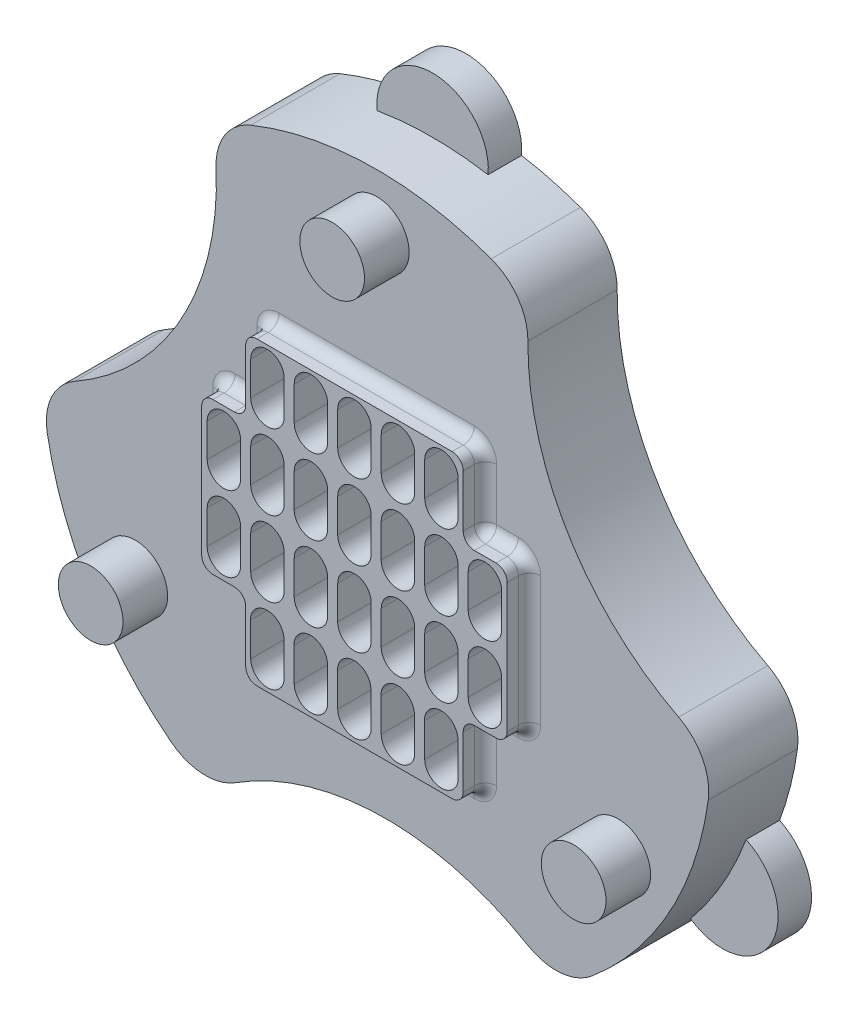
from build123d import *

# Parameters (mm, degrees)
SKETCH2_R           = 18.85
BOSS_EXTRUDE1_DEPTH = 8
SKETCH3_R           = 30
SKETCH3_R_2         = 17.600030795
BOSS_EXTRUDE2_DEPTH = 8
SKETCH4_R           = 2.9
BOSS_EXTRUDE3_DEPTH = 4
SKETCH6_R           = 5
BOSS_EXTRUDE4_DEPTH = 3
SKETCH5_R           = 3
CUT_EXTRUDE1_DEPTH  = 3
SKETCH7_R           = 25
CUT_EXTRUDE2_DEPTH  = 8
FILLET1_R           = 5
SKETCH2_2_R         = 18.85
BOSS_EXTRUDE5_DEPTH = 10
SKETCH8_R           = 20.511068925
CUT_EXTRUDE3_DEPTH  = 2
FILLET2_R           = 1
FILLET3_R           = 1


with BuildPart() as part:
    # Sketch2 → Boss-Extrude1 (new body)
    with BuildSketch(Plane.XY.offset(10)):
        Circle(SKETCH2_R)
        with BuildLine():
            Line((-6.300750604, 11.631897337), (-6.301949779, 8.631897576))
            ThreePointArc((-6.301949779, 8.631897576), (-7.802549247, 7.132497284), (-9.30194954, 8.633096752))
            Line((-9.30194954, 8.633096752), (-9.300750364, 11.633096512))
            ThreePointArc((-9.300750364, 11.633096512), (-7.800150896, 13.132496805), (-6.300750604, 11.631897337))
        make_face(mode=Mode.SUBTRACT)
        with BuildLine():
            Line((-5.400750364, 11.633096512), (-5.40194954, 8.633096752))
            ThreePointArc((-5.40194954, 8.633096752), (-3.902549247, 7.132497284), (-2.401949779, 8.631897576))
            Line((-2.401949779, 8.631897576), (-2.400750604, 11.631897337))
            ThreePointArc((-2.400750604, 11.631897337), (-3.900150896, 13.132496805), (-5.400750364, 11.633096512))
        make_face(mode=Mode.SUBTRACT)
        with BuildLine():
            Line((-1.500750364, 11.633096512), (-1.50194954, 8.633096752))
            ThreePointArc((-1.50194954, 8.633096752), (-0.002549247, 7.132497284), (1.498050221, 8.631897576))
            Line((1.498050221, 8.631897576), (1.499249396, 11.631897337))
            ThreePointArc((1.499249396, 11.631897337), (-0.000150896, 13.132496805), (-1.500750364, 11.633096512))
        make_face(mode=Mode.SUBTRACT)
        with BuildLine():
            Line((2.399249636, 11.633096512), (2.39805046, 8.633096752))
            ThreePointArc((2.39805046, 8.633096752), (3.897450753, 7.132497284), (5.398050221, 8.631897576))
            Line((5.398050221, 8.631897576), (5.399249396, 11.631897337))
            ThreePointArc((5.399249396, 11.631897337), (3.899849104, 13.132496805), (2.399249636, 11.633096512))
        make_face(mode=Mode.SUBTRACT)
        with BuildLine():
            Line((6.299249636, 11.633096512), (6.29805046, 8.633096752))
            ThreePointArc((6.29805046, 8.633096752), (7.797450753, 7.132497284), (9.298050221, 8.631897576))
            Line((9.298050221, 8.631897576), (9.299249396, 11.631897337))
            ThreePointArc((9.299249396, 11.631897337), (7.799849104, 13.132496805), (6.299249636, 11.633096512))
        make_face(mode=Mode.SUBTRACT)
        with BuildLine():
            Line((-10.203450815, 1.876748439), (-10.201950263, 4.876748439))
            ThreePointArc((-10.201950263, 4.876748439), (-11.701199799, 6.377498527), (-13.201949888, 4.878248991))
            Line((-13.201949888, 4.878248991), (-13.20345044, 1.878248991))
            ThreePointArc((-13.20345044, 1.878248991), (-11.704200903, 0.377498902), (-10.203450815, 1.876748439))
        make_face(mode=Mode.SUBTRACT)
        with BuildLine():
            Line((-9.303450024, 1.878248991), (-9.301949472, 4.878248991))
            ThreePointArc((-9.301949472, 4.878248991), (-7.801199384, 6.377498527), (-6.301949847, 4.876748439))
            Line((-6.301949847, 4.876748439), (-6.3034504, 1.876748439))
            ThreePointArc((-6.3034504, 1.876748439), (-7.804200488, 0.377498902), (-9.303450024, 1.878248991))
        make_face(mode=Mode.SUBTRACT)
        with BuildLine():
            Line((-2.4034504, 1.876748439), (-2.401949847, 4.876748439))
            ThreePointArc((-2.401949847, 4.876748439), (-3.901199384, 6.377498527), (-5.401949472, 4.878248991))
            Line((-5.401949472, 4.878248991), (-5.403450024, 1.878248991))
            ThreePointArc((-5.403450024, 1.878248991), (-3.904200488, 0.377498902), (-2.4034504, 1.876748439))
        make_face(mode=Mode.SUBTRACT)
        with BuildLine():
            Line((1.4965496, 1.876748439), (1.498050153, 4.876748439))
            ThreePointArc((1.498050153, 4.876748439), (-0.001199384, 6.377498527), (-1.501949472, 4.878248991))
            Line((-1.501949472, 4.878248991), (-1.503450024, 1.878248991))
            ThreePointArc((-1.503450024, 1.878248991), (-0.004200488, 0.377498902), (1.4965496, 1.876748439))
        make_face(mode=Mode.SUBTRACT)
        with BuildLine():
            Line((5.3965496, 1.876748439), (5.398050153, 4.876748439))
            ThreePointArc((5.398050153, 4.876748439), (3.898800616, 6.377498527), (2.398050528, 4.878248991))
            Line((2.398050528, 4.878248991), (2.396549976, 1.878248991))
            ThreePointArc((2.396549976, 1.878248991), (3.895799512, 0.377498902), (5.3965496, 1.876748439))
        make_face(mode=Mode.SUBTRACT)
        with BuildLine():
            Line((9.2965496, 1.876748439), (9.298050153, 4.876748439))
            ThreePointArc((9.298050153, 4.876748439), (7.798800616, 6.377498527), (6.298050528, 4.878248991))
            Line((6.298050528, 4.878248991), (6.296549976, 1.878248991))
            ThreePointArc((6.296549976, 1.878248991), (7.795799512, 0.377498902), (9.2965496, 1.876748439))
        make_face(mode=Mode.SUBTRACT)
        with BuildLine():
            Line((13.1965496, 1.876748439), (13.198050153, 4.876748439))
            ThreePointArc((13.198050153, 4.876748439), (11.698800616, 6.377498527), (10.198050528, 4.878248991))
            Line((10.198050528, 4.878248991), (10.196549976, 1.878248991))
            ThreePointArc((10.196549976, 1.878248991), (11.695799512, 0.377498902), (13.1965496, 1.876748439))
        make_face(mode=Mode.SUBTRACT)
        with BuildLine():
            Line((-9.304647729, -4.877109305), (-9.30074961, -1.877109305))
            ThreePointArc((-9.30074961, -1.877109305), (-7.798801818, -0.37905963), (-6.300752142, -1.881007421))
            Line((-6.300752142, -1.881007421), (-6.304650262, -4.881007421))
            ThreePointArc((-6.304650262, -4.881007421), (-7.806598054, -6.379057097), (-9.304647729, -4.877109305))
        make_face(mode=Mode.SUBTRACT)
        with BuildLine():
            Line((-2.404650262, -4.881007421), (-2.400752142, -1.881007421))
            ThreePointArc((-2.400752142, -1.881007421), (-3.898801818, -0.37905963), (-5.40074961, -1.877109305))
            Line((-5.40074961, -1.877109305), (-5.404647729, -4.877109305))
            ThreePointArc((-5.404647729, -4.877109305), (-3.906598054, -6.379057097), (-2.404650262, -4.881007421))
        make_face(mode=Mode.SUBTRACT)
        with BuildLine():
            Line((1.495349738, -4.881007421), (1.499247858, -1.881007421))
            ThreePointArc((1.499247858, -1.881007421), (0.001198182, -0.37905963), (-1.50074961, -1.877109305))
            Line((-1.50074961, -1.877109305), (-1.504647729, -4.877109305))
            ThreePointArc((-1.504647729, -4.877109305), (-0.006598054, -6.379057097), (1.495349738, -4.881007421))
        make_face(mode=Mode.SUBTRACT)
        with BuildLine():
            Line((5.395349738, -4.881007421), (5.399247858, -1.881007421))
            ThreePointArc((5.399247858, -1.881007421), (3.901198182, -0.37905963), (2.39925039, -1.877109305))
            Line((2.39925039, -1.877109305), (2.395352271, -4.877109305))
            ThreePointArc((2.395352271, -4.877109305), (3.893401946, -6.379057097), (5.395349738, -4.881007421))
        make_face(mode=Mode.SUBTRACT)
        with BuildLine():
            Line((9.295349738, -4.881007421), (9.299247858, -1.881007421))
            ThreePointArc((9.299247858, -1.881007421), (7.801198182, -0.37905963), (6.29925039, -1.877109305))
            Line((6.29925039, -1.877109305), (6.295352271, -4.877109305))
            ThreePointArc((6.295352271, -4.877109305), (7.793401946, -6.379057097), (9.295349738, -4.881007421))
        make_face(mode=Mode.SUBTRACT)
        with BuildLine():
            Line((13.195349738, -4.881007421), (13.199247858, -1.881007421))
            ThreePointArc((13.199247858, -1.881007421), (11.701198182, -0.37905963), (10.19925039, -1.877109305))
            Line((10.19925039, -1.877109305), (10.195352271, -4.877109305))
            ThreePointArc((10.195352271, -4.877109305), (11.693401946, -6.379057097), (13.195349738, -4.881007421))
        make_face(mode=Mode.SUBTRACT)
        with BuildLine():
            Line((-10.204650262, -4.881007421), (-10.200752142, -1.881007421))
            ThreePointArc((-10.200752142, -1.881007421), (-11.698801818, -0.37905963), (-13.20074961, -1.877109305))
            Line((-13.20074961, -1.877109305), (-13.204647729, -4.877109305))
            ThreePointArc((-13.204647729, -4.877109305), (-11.706598054, -6.379057097), (-10.204650262, -4.881007421))
        make_face(mode=Mode.SUBTRACT)
        with BuildLine():
            Line((-6.325942117, -8.623046013), (-6.300802019, -11.623046013))
            ThreePointArc((-6.300802019, -11.623046013), (-7.788179745, -13.135562955), (-9.300696687, -11.648185229))
            Line((-9.300696687, -11.648185229), (-9.325836785, -8.648185229))
            ThreePointArc((-9.325836785, -8.648185229), (-7.838459059, -7.135668287), (-6.325942117, -8.623046013))
        make_face(mode=Mode.SUBTRACT)
        with BuildLine():
            Line((-5.425836785, -8.648185229), (-5.400696687, -11.648185229))
            ThreePointArc((-5.400696687, -11.648185229), (-3.888179745, -13.135562955), (-2.400802019, -11.623046013))
            Line((-2.400802019, -11.623046013), (-2.425942117, -8.623046013))
            ThreePointArc((-2.425942117, -8.623046013), (-3.938459059, -7.135668287), (-5.425836785, -8.648185229))
        make_face(mode=Mode.SUBTRACT)
        with BuildLine():
            Line((-1.525836785, -8.648185229), (-1.500696687, -11.648185229))
            ThreePointArc((-1.500696687, -11.648185229), (0.011820255, -13.135562955), (1.499197981, -11.623046013))
            Line((1.499197981, -11.623046013), (1.474057883, -8.623046013))
            ThreePointArc((1.474057883, -8.623046013), (-0.038459059, -7.135668287), (-1.525836785, -8.648185229))
        make_face(mode=Mode.SUBTRACT)
        with BuildLine():
            Line((2.374163215, -8.648185229), (2.399303313, -11.648185229))
            ThreePointArc((2.399303313, -11.648185229), (3.911820255, -13.135562955), (5.399197981, -11.623046013))
            Line((5.399197981, -11.623046013), (5.374057883, -8.623046013))
            ThreePointArc((5.374057883, -8.623046013), (3.861540941, -7.135668287), (2.374163215, -8.648185229))
        make_face(mode=Mode.SUBTRACT)
        with BuildLine():
            Line((6.274163215, -8.648185229), (6.299303313, -11.648185229))
            ThreePointArc((6.299303313, -11.648185229), (7.811820255, -13.135562955), (9.299197981, -11.623046013))
            Line((9.299197981, -11.623046013), (9.274057883, -8.623046013))
            ThreePointArc((9.274057883, -8.623046013), (7.761540941, -7.135668287), (6.274163215, -8.648185229))
        make_face(mode=Mode.SUBTRACT)
    extrude(amount=BOSS_EXTRUDE1_DEPTH)

    # Sketch3 → Boss-Extrude2 (add)
    with BuildSketch(Plane.XY.offset(18)):
        Circle(SKETCH3_R)
        Circle(SKETCH3_R_2, mode=Mode.SUBTRACT)
    extrude(amount=-BOSS_EXTRUDE2_DEPTH)

    # Sketch4 → Boss-Extrude3 (add)
    with BuildSketch(Plane.XY.offset(18)):
        with Locations((0, 25)):
            Circle(SKETCH4_R)
        with Locations((21.650635095, -12.5)):
            Circle(SKETCH4_R)
        with Locations((-21.650635095, -12.5)):
            Circle(SKETCH4_R)
    extrude(amount=BOSS_EXTRUDE3_DEPTH)

    # Sketch6 → Boss-Extrude4 (add)
    with BuildSketch(Plane(origin=(0, 0, 10), x_dir=(-1, 0, 0), z_dir=(0, 0, -1))):
        with Locations((0, 30)):
            Circle(SKETCH6_R)
        with Locations((25.980762114, -15)):
            Circle(SKETCH6_R)
        with Locations((-25.980762114, -15)):
            Circle(SKETCH6_R)
    extrude(amount=-BOSS_EXTRUDE4_DEPTH)

    # Sketch5 → Cut-Extrude1 (cut)
    with BuildSketch(Plane(origin=(0, 0, 10), x_dir=(-1, 0, 0), z_dir=(0, 0, -1))):
        with Locations((0, 25)):
            Circle(SKETCH5_R)
        with Locations((21.650635095, -12.5)):
            Circle(SKETCH5_R)
        with Locations((-21.650635095, -12.5)):
            Circle(SKETCH5_R)
    extrude(amount=-CUT_EXTRUDE1_DEPTH, mode=Mode.SUBTRACT)

    # Sketch7 → Cut-Extrude2 (cut)
    with BuildSketch(Plane(origin=(0, 0, 10), x_dir=(-1, 0, 0), z_dir=(0, 0, -1))):
        with Locations((-38.550089681, 23.214017006)):
            Circle(SKETCH7_R)
        with Locations((39.378973292, 21.778348479)):
            Circle(SKETCH7_R)
        with Locations((-0.828883611, -44.992365485)):
            Circle(SKETCH7_R)
    extrude(amount=-CUT_EXTRUDE2_DEPTH, mode=Mode.SUBTRACT)

    # Fillet1
    fillet1_edges = [part.edges().sort_by_distance(p)[0] for p in [
        (29.998712087, -0.277980381, 14),
        (13.786574958, 26.644518215, 14),
        (-14.758617972, 26.118636939, 14),
        (-29.968117125, -1.382734963, 14),
        (-15.240094116, -25.840656558, 14),
        (16.181542167, -25.261783252, 14),
    ]]
    fillet(fillet1_edges, radius=FILLET1_R)

    # Sketch2<2> → Boss-Extrude5 (add)
    with BuildSketch(Plane.XY.offset(10)):
        Circle(SKETCH2_2_R)
        with BuildLine():
            Line((-6.300750604, 11.631897337), (-6.301949779, 8.631897576))
            ThreePointArc((-6.301949779, 8.631897576), (-7.802549247, 7.132497284), (-9.30194954, 8.633096752))
            Line((-9.30194954, 8.633096752), (-9.300750364, 11.633096512))
            ThreePointArc((-9.300750364, 11.633096512), (-7.800150896, 13.132496805), (-6.300750604, 11.631897337))
        make_face(mode=Mode.SUBTRACT)
        with BuildLine():
            Line((-5.400750364, 11.633096512), (-5.40194954, 8.633096752))
            ThreePointArc((-5.40194954, 8.633096752), (-3.902549247, 7.132497284), (-2.401949779, 8.631897576))
            Line((-2.401949779, 8.631897576), (-2.400750604, 11.631897337))
            ThreePointArc((-2.400750604, 11.631897337), (-3.900150896, 13.132496805), (-5.400750364, 11.633096512))
        make_face(mode=Mode.SUBTRACT)
        with BuildLine():
            Line((-1.500750364, 11.633096512), (-1.50194954, 8.633096752))
            ThreePointArc((-1.50194954, 8.633096752), (-0.002549247, 7.132497284), (1.498050221, 8.631897576))
            Line((1.498050221, 8.631897576), (1.499249396, 11.631897337))
            ThreePointArc((1.499249396, 11.631897337), (-0.000150896, 13.132496805), (-1.500750364, 11.633096512))
        make_face(mode=Mode.SUBTRACT)
        with BuildLine():
            Line((2.399249636, 11.633096512), (2.39805046, 8.633096752))
            ThreePointArc((2.39805046, 8.633096752), (3.897450753, 7.132497284), (5.398050221, 8.631897576))
            Line((5.398050221, 8.631897576), (5.399249396, 11.631897337))
            ThreePointArc((5.399249396, 11.631897337), (3.899849104, 13.132496805), (2.399249636, 11.633096512))
        make_face(mode=Mode.SUBTRACT)
        with BuildLine():
            Line((6.299249636, 11.633096512), (6.29805046, 8.633096752))
            ThreePointArc((6.29805046, 8.633096752), (7.797450753, 7.132497284), (9.298050221, 8.631897576))
            Line((9.298050221, 8.631897576), (9.299249396, 11.631897337))
            ThreePointArc((9.299249396, 11.631897337), (7.799849104, 13.132496805), (6.299249636, 11.633096512))
        make_face(mode=Mode.SUBTRACT)
        with BuildLine():
            Line((-10.203450815, 1.876748439), (-10.201950263, 4.876748439))
            ThreePointArc((-10.201950263, 4.876748439), (-11.701199799, 6.377498527), (-13.201949888, 4.878248991))
            Line((-13.201949888, 4.878248991), (-13.20345044, 1.878248991))
            ThreePointArc((-13.20345044, 1.878248991), (-11.704200903, 0.377498902), (-10.203450815, 1.876748439))
        make_face(mode=Mode.SUBTRACT)
        with BuildLine():
            Line((-9.303450024, 1.878248991), (-9.301949472, 4.878248991))
            ThreePointArc((-9.301949472, 4.878248991), (-7.801199384, 6.377498527), (-6.301949847, 4.876748439))
            Line((-6.301949847, 4.876748439), (-6.3034504, 1.876748439))
            ThreePointArc((-6.3034504, 1.876748439), (-7.804200488, 0.377498902), (-9.303450024, 1.878248991))
        make_face(mode=Mode.SUBTRACT)
        with BuildLine():
            Line((-2.4034504, 1.876748439), (-2.401949847, 4.876748439))
            ThreePointArc((-2.401949847, 4.876748439), (-3.901199384, 6.377498527), (-5.401949472, 4.878248991))
            Line((-5.401949472, 4.878248991), (-5.403450024, 1.878248991))
            ThreePointArc((-5.403450024, 1.878248991), (-3.904200488, 0.377498902), (-2.4034504, 1.876748439))
        make_face(mode=Mode.SUBTRACT)
        with BuildLine():
            Line((1.4965496, 1.876748439), (1.498050153, 4.876748439))
            ThreePointArc((1.498050153, 4.876748439), (-0.001199384, 6.377498527), (-1.501949472, 4.878248991))
            Line((-1.501949472, 4.878248991), (-1.503450024, 1.878248991))
            ThreePointArc((-1.503450024, 1.878248991), (-0.004200488, 0.377498902), (1.4965496, 1.876748439))
        make_face(mode=Mode.SUBTRACT)
        with BuildLine():
            Line((5.3965496, 1.876748439), (5.398050153, 4.876748439))
            ThreePointArc((5.398050153, 4.876748439), (3.898800616, 6.377498527), (2.398050528, 4.878248991))
            Line((2.398050528, 4.878248991), (2.396549976, 1.878248991))
            ThreePointArc((2.396549976, 1.878248991), (3.895799512, 0.377498902), (5.3965496, 1.876748439))
        make_face(mode=Mode.SUBTRACT)
        with BuildLine():
            Line((9.2965496, 1.876748439), (9.298050153, 4.876748439))
            ThreePointArc((9.298050153, 4.876748439), (7.798800616, 6.377498527), (6.298050528, 4.878248991))
            Line((6.298050528, 4.878248991), (6.296549976, 1.878248991))
            ThreePointArc((6.296549976, 1.878248991), (7.795799512, 0.377498902), (9.2965496, 1.876748439))
        make_face(mode=Mode.SUBTRACT)
        with BuildLine():
            Line((13.1965496, 1.876748439), (13.198050153, 4.876748439))
            ThreePointArc((13.198050153, 4.876748439), (11.698800616, 6.377498527), (10.198050528, 4.878248991))
            Line((10.198050528, 4.878248991), (10.196549976, 1.878248991))
            ThreePointArc((10.196549976, 1.878248991), (11.695799512, 0.377498902), (13.1965496, 1.876748439))
        make_face(mode=Mode.SUBTRACT)
        with BuildLine():
            Line((-9.304647729, -4.877109305), (-9.30074961, -1.877109305))
            ThreePointArc((-9.30074961, -1.877109305), (-7.798801818, -0.37905963), (-6.300752142, -1.881007421))
            Line((-6.300752142, -1.881007421), (-6.304650262, -4.881007421))
            ThreePointArc((-6.304650262, -4.881007421), (-7.806598054, -6.379057097), (-9.304647729, -4.877109305))
        make_face(mode=Mode.SUBTRACT)
        with BuildLine():
            Line((-2.404650262, -4.881007421), (-2.400752142, -1.881007421))
            ThreePointArc((-2.400752142, -1.881007421), (-3.898801818, -0.37905963), (-5.40074961, -1.877109305))
            Line((-5.40074961, -1.877109305), (-5.404647729, -4.877109305))
            ThreePointArc((-5.404647729, -4.877109305), (-3.906598054, -6.379057097), (-2.404650262, -4.881007421))
        make_face(mode=Mode.SUBTRACT)
        with BuildLine():
            Line((1.495349738, -4.881007421), (1.499247858, -1.881007421))
            ThreePointArc((1.499247858, -1.881007421), (0.001198182, -0.37905963), (-1.50074961, -1.877109305))
            Line((-1.50074961, -1.877109305), (-1.504647729, -4.877109305))
            ThreePointArc((-1.504647729, -4.877109305), (-0.006598054, -6.379057097), (1.495349738, -4.881007421))
        make_face(mode=Mode.SUBTRACT)
        with BuildLine():
            Line((5.395349738, -4.881007421), (5.399247858, -1.881007421))
            ThreePointArc((5.399247858, -1.881007421), (3.901198182, -0.37905963), (2.39925039, -1.877109305))
            Line((2.39925039, -1.877109305), (2.395352271, -4.877109305))
            ThreePointArc((2.395352271, -4.877109305), (3.893401946, -6.379057097), (5.395349738, -4.881007421))
        make_face(mode=Mode.SUBTRACT)
        with BuildLine():
            Line((9.295349738, -4.881007421), (9.299247858, -1.881007421))
            ThreePointArc((9.299247858, -1.881007421), (7.801198182, -0.37905963), (6.29925039, -1.877109305))
            Line((6.29925039, -1.877109305), (6.295352271, -4.877109305))
            ThreePointArc((6.295352271, -4.877109305), (7.793401946, -6.379057097), (9.295349738, -4.881007421))
        make_face(mode=Mode.SUBTRACT)
        with BuildLine():
            Line((13.195349738, -4.881007421), (13.199247858, -1.881007421))
            ThreePointArc((13.199247858, -1.881007421), (11.701198182, -0.37905963), (10.19925039, -1.877109305))
            Line((10.19925039, -1.877109305), (10.195352271, -4.877109305))
            ThreePointArc((10.195352271, -4.877109305), (11.693401946, -6.379057097), (13.195349738, -4.881007421))
        make_face(mode=Mode.SUBTRACT)
        with BuildLine():
            Line((-10.204650262, -4.881007421), (-10.200752142, -1.881007421))
            ThreePointArc((-10.200752142, -1.881007421), (-11.698801818, -0.37905963), (-13.20074961, -1.877109305))
            Line((-13.20074961, -1.877109305), (-13.204647729, -4.877109305))
            ThreePointArc((-13.204647729, -4.877109305), (-11.706598054, -6.379057097), (-10.204650262, -4.881007421))
        make_face(mode=Mode.SUBTRACT)
        with BuildLine():
            Line((-6.325942117, -8.623046013), (-6.300802019, -11.623046013))
            ThreePointArc((-6.300802019, -11.623046013), (-7.788179745, -13.135562955), (-9.300696687, -11.648185229))
            Line((-9.300696687, -11.648185229), (-9.325836785, -8.648185229))
            ThreePointArc((-9.325836785, -8.648185229), (-7.838459059, -7.135668287), (-6.325942117, -8.623046013))
        make_face(mode=Mode.SUBTRACT)
        with BuildLine():
            Line((-5.425836785, -8.648185229), (-5.400696687, -11.648185229))
            ThreePointArc((-5.400696687, -11.648185229), (-3.888179745, -13.135562955), (-2.400802019, -11.623046013))
            Line((-2.400802019, -11.623046013), (-2.425942117, -8.623046013))
            ThreePointArc((-2.425942117, -8.623046013), (-3.938459059, -7.135668287), (-5.425836785, -8.648185229))
        make_face(mode=Mode.SUBTRACT)
        with BuildLine():
            Line((-1.525836785, -8.648185229), (-1.500696687, -11.648185229))
            ThreePointArc((-1.500696687, -11.648185229), (0.011820255, -13.135562955), (1.499197981, -11.623046013))
            Line((1.499197981, -11.623046013), (1.474057883, -8.623046013))
            ThreePointArc((1.474057883, -8.623046013), (-0.038459059, -7.135668287), (-1.525836785, -8.648185229))
        make_face(mode=Mode.SUBTRACT)
        with BuildLine():
            Line((2.374163215, -8.648185229), (2.399303313, -11.648185229))
            ThreePointArc((2.399303313, -11.648185229), (3.911820255, -13.135562955), (5.399197981, -11.623046013))
            Line((5.399197981, -11.623046013), (5.374057883, -8.623046013))
            ThreePointArc((5.374057883, -8.623046013), (3.861540941, -7.135668287), (2.374163215, -8.648185229))
        make_face(mode=Mode.SUBTRACT)
        with BuildLine():
            Line((6.274163215, -8.648185229), (6.299303313, -11.648185229))
            ThreePointArc((6.299303313, -11.648185229), (7.811820255, -13.135562955), (9.299197981, -11.623046013))
            Line((9.299197981, -11.623046013), (9.274057883, -8.623046013))
            ThreePointArc((9.274057883, -8.623046013), (7.761540941, -7.135668287), (6.274163215, -8.648185229))
        make_face(mode=Mode.SUBTRACT)
    extrude(amount=BOSS_EXTRUDE5_DEPTH)

    # Sketch8 → Cut-Extrude3 (cut)
    with BuildSketch(Plane.XY.offset(20)):
        Circle(SKETCH8_R)
        Polygon((-9.74952037, -13.473579653), (-9.74952037, -6.792613611), (-13.695327423, -6.792613611), (-13.695327423, 6.792613611), (-9.74952037, 6.792613611), (-9.74952037, 13.473579653), (9.74952037, 13.473579653), (9.74952037, 6.792613611), (13.695327423, 6.792613611), (13.695327423, -6.792613611), (9.74952037, -6.792613611), (9.74952037, -13.473579653), align=None, mode=Mode.SUBTRACT)
    extrude(amount=-CUT_EXTRUDE3_DEPTH, mode=Mode.SUBTRACT)

    # Fillet2
    fillet2_edges = [part.edges().sort_by_distance(p)[0] for p in [
        (-9.74952037, -13.473579653, 19),
        (9.74952037, -13.473579653, 19),
        (9.74952037, -6.792613611, 19),
        (13.695327423, -6.792613611, 19),
        (13.695327423, 6.792613611, 19),
        (9.74952037, 6.792613611, 19),
        (9.74952037, 13.473579653, 19),
        (-9.74952037, 13.473579653, 19),
        (-9.74952037, 6.792613611, 19),
        (-13.695327423, 6.792613611, 19),
        (-13.695327423, -6.792613611, 19),
        (-9.74952037, -6.792613611, 19),
    ]]
    fillet(fillet2_edges, radius=FILLET2_R)

    # Fillet3
    fillet3_edges = [part.edges().sort_by_distance(p)[0] for p in [
        (9.74952037, 10.133096632, 18),
        (0, 13.473579653, 18),
        (11.722423897, 6.792613611, 18),
        (0, -13.473579653, 18),
        (-9.74952037, -10.133096632, 18),
        (-11.722423897, -6.792613611, 18),
        (-13.695327423, 0, 18),
        (-11.722423897, 6.792613611, 18),
        (-9.74952037, 10.133096632, 18),
        (13.695327423, 0, 18),
        (11.722423897, -6.792613611, 18),
        (9.74952037, -10.133096632, 18),
        (-10.042413589, 7.08550683, 18),
        (-10.042413589, -7.08550683, 18),
        (10.042413589, -7.08550683, 18),
        (10.042413589, 7.08550683, 18),
        (9.456627151, 13.180686434, 18),
        (13.402434205, 6.499720393, 18),
        (13.402434205, -6.499720393, 18),
        (9.456627151, -13.180686434, 18),
        (-9.456627151, -13.180686434, 18),
        (-13.402434205, -6.499720393, 18),
        (-13.402434205, 6.499720393, 18),
        (-9.456627151, 13.180686434, 18),
    ]]
    fillet(fillet3_edges, radius=FILLET3_R)


solid = part.part
